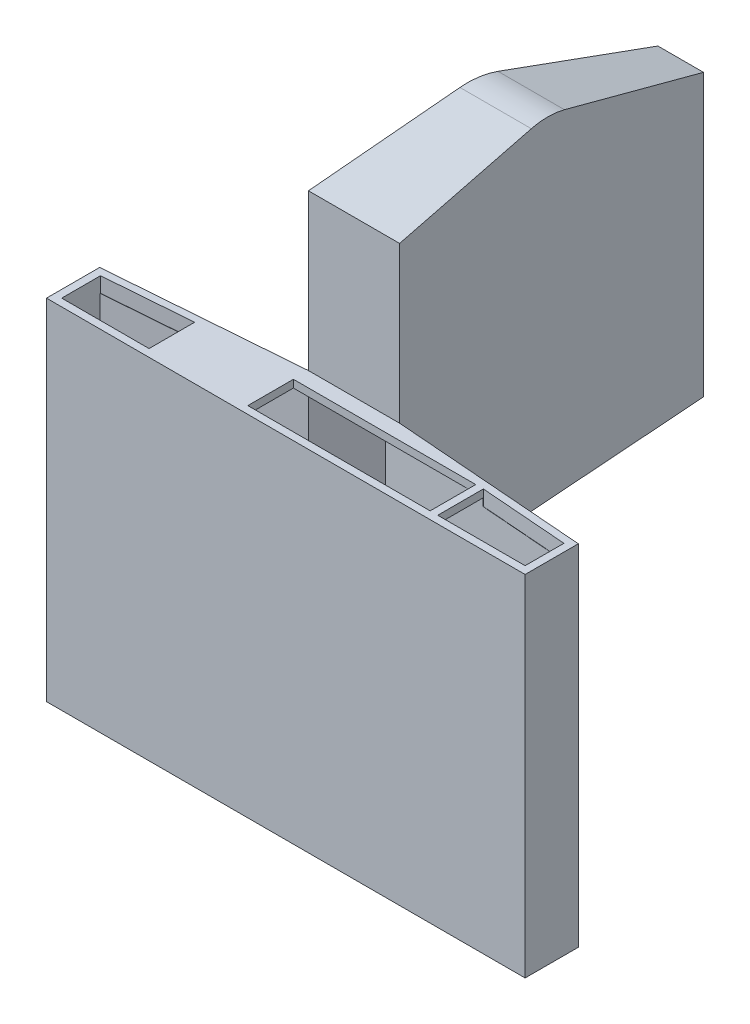
from build123d import *

# Parameters (mm, degrees)
BOSS_EXTRUDE1_DEPTH     = 70
CUT_EXTRUDE5_DEPTH      = 24
CUT_EXTRUDE4_DEPTH      = 50
CUT_EXTRUDE4_DEPTH_BACK = 50
SHELL2_T                = -1
FILLET1_R               = 10
CUT_EXTRUDE3_DEPTH      = 26
CUT_EXTRUDE2_DEPTH      = 1
CUT_EXTRUDE2_DEPTH_BACK = 1
SKETCH4_W               = 24
SKETCH4_H               = 6


with BuildPart() as part:
    # Sketch2 → Boss-Extrude1 (new body)
    with BuildSketch(Plane(origin=(0, 0, 0), x_dir=(1, 0, 0), z_dir=(0, 1, 0))):
        Polygon((-18.988562983, 28.382917999), (-4.988562983, 29.470238095), (-1.988562983, 72.470238095), (4.011437017, 72.470238095), (7.011437017, 29.470238095), (32.511437017, 27.489762205), (32.511437017, 20.489762205), (-30.488562983, 20.489762205), (-30.488562983, 27.489762205), align=None)
    extrude(amount=BOSS_EXTRUDE1_DEPTH)

    # Sketch26 → Cut-Extrude5 (cut)
    with BuildSketch(Plane(origin=(0, 70, 0), x_dir=(1, 0, 0), z_dir=(0, 1, 0))):
        Polygon((-4.988562983, 29.470238095), (7.011437017, 29.470238095), (32.511437017, 27.489762205), (32.511437017, 20.489762205), (-30.488562983, 20.489762205), (-30.488562983, 27.489762205), align=None)
    extrude(amount=-CUT_EXTRUDE5_DEPTH, mode=Mode.SUBTRACT)

    # Sketch7 → Cut-Extrude4 (cut, two sides: drawn at the far end of the back side and taken through both)
    with BuildSketch(Plane(origin=(0, 0, 0), x_dir=(0, 0, -1), z_dir=(1, 0, 0)).offset(-CUT_EXTRUDE4_DEPTH_BACK)):
        Polygon((50.489762205, 70), (20.489762205, 70), (20.489762205, 65), align=None)
        Polygon((72.470238095, 70), (50.489762205, 70), (72.470238095, 63), align=None)
    extrude(amount=CUT_EXTRUDE4_DEPTH + CUT_EXTRUDE4_DEPTH_BACK, mode=Mode.SUBTRACT)

    # Shell2
    shell2_openings = [part.faces().sort_by_distance(p)[0] for p in [
        (1.011437017, 0, -34.888692943),
    ]]
    offset(amount=SHELL2_T, openings=shell2_openings, kind=Kind.INTERSECTION)

    # Fillet1
    fillet1_edges = [part.edges().sort_by_distance(p)[0] for p in [
        (1.011437017, 70, -50.489762205),
    ]]
    fillet(fillet1_edges, radius=FILLET1_R)

    # Sketch6 → Cut-Extrude3 (cut)
    with BuildSketch(Plane.XZ):
        Polygon((-4.988562983, -29.470238095), (7.011437017, -29.470238095), (4.011437017, -72.470238095), (-1.988562983, -72.470238095), align=None)
    extrude(amount=-CUT_EXTRUDE3_DEPTH, mode=Mode.SUBTRACT)

    # Sketch4 → Cut-Extrude2 (cut, two sides: drawn at the far end of the back side and taken through both)
    with BuildSketch(Plane(origin=(0, 45, 0), x_dir=(1, 0, 0), z_dir=(0, 1, 0)).offset(-CUT_EXTRUDE2_DEPTH_BACK)):
        Polygon((-29.488562983, 26.596606412), (-17.988562983, 27.489762205), (-17.988562983, 21.489762205), (-29.488562983, 21.489762205), align=None)
        Polygon((31.511437017, 21.489762205), (20.011437017, 21.489762205), (20.011437017, 27.489762205), (31.511437017, 26.596606412), align=None)
        with Locations((7.011437017, 24.489762205)):
            Rectangle(SKETCH4_W, SKETCH4_H)
    extrude(amount=CUT_EXTRUDE2_DEPTH + CUT_EXTRUDE2_DEPTH_BACK, mode=Mode.SUBTRACT)


solid = part.part
